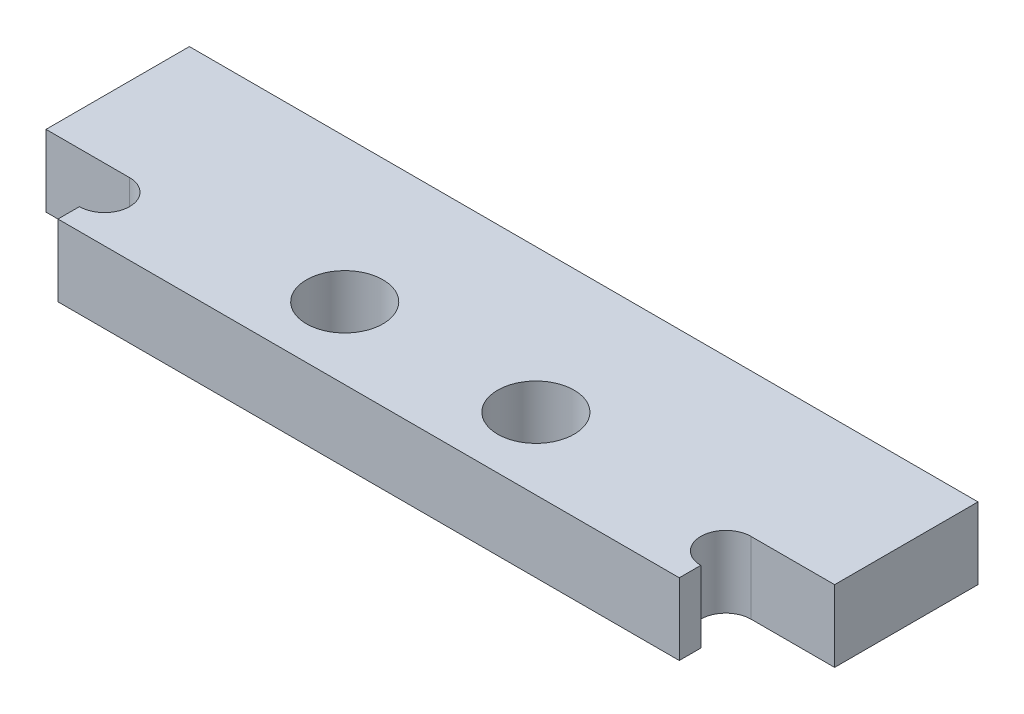
from build123d import *

# Parameters (mm, degrees)
SKETCH_1_R      = 1.6
EXTRUDE_1_DEPTH = 3


with BuildPart() as part:
    # 草图1 → 凸台-拉伸1 (new body)
    with BuildSketch(Plane(origin=(0, 0, 0), x_dir=(1, 0, 0), z_dir=(0, 1, 0))):
        with BuildLine():
            Line((-13, -6), (13, -6))
            Line((13, -6), (13, -5.1))
            ThreePointArc((13, -5.1), (11.95, -4.05), (13, -3))
            Line((13, -3), (16.5, -3))
            Line((16.5, -3), (16.5, 3))
            Line((16.5, 3), (13, 3))
            Line((13, 3), (-13, 3))
            Line((-13, 3), (-16.5, 3))
            Line((-16.5, 3), (-16.5, -3))
            Line((-16.5, -3), (-13, -3))
            ThreePointArc((-13, -3), (-12.25753788, -3.30753788), (-11.95, -4.05))
            ThreePointArc((-11.95, -4.05), (-12.25753788, -4.79246212), (-13, -5.1))
            Line((-13, -5.1), (-13, -6))
        make_face()
        with Locations(Location((-4, -3, 0), (0, 0, 270))):
            Circle(SKETCH_1_R, mode=Mode.SUBTRACT)
        with Locations(Location((4, -3, 0), (0, 0, 270))):
            Circle(SKETCH_1_R, mode=Mode.SUBTRACT)
    extrude(amount=EXTRUDE_1_DEPTH)


solid = part.part
